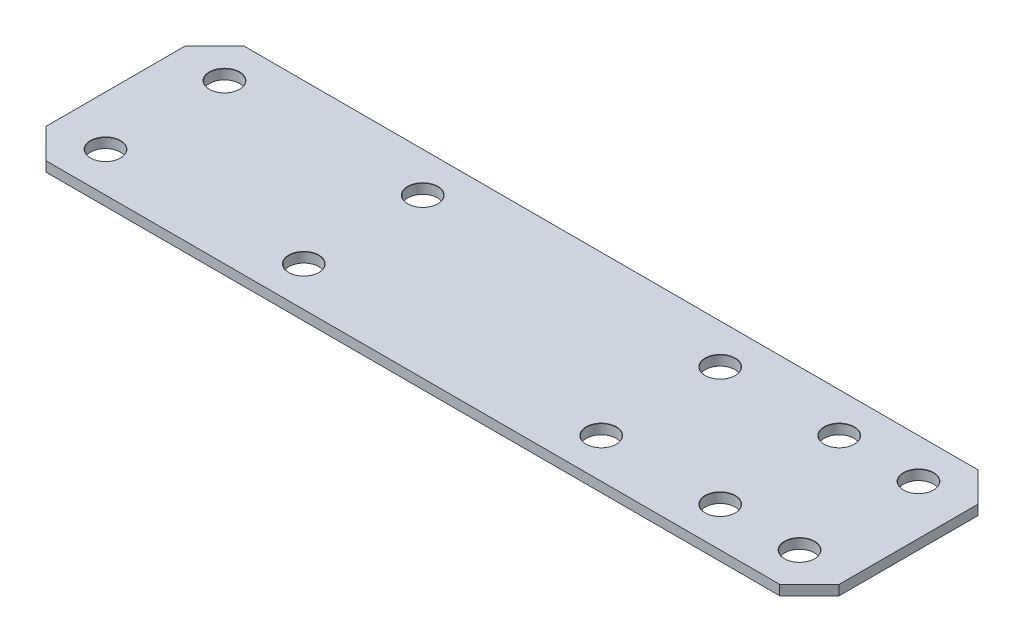
from build123d import *

# Parameters (mm, degrees)
SKETCH_1_W            = 80
SKETCH_1_H            = 20
EXTRUDE_1_DEPTH       = 1
F_3_0MM_1_AT_2_COUNT  = 2
F_3_0MM_1_AT_2_PITCH  = 12
F_3_0MM_1_AT_3_COUNT  = 2
F_3_0MM_1_AT_3_PITCH  = 20
F_3_0MM_1_AT_4_COUNT  = 2
F_3_0MM_1_AT_4_PITCH  = 50
F_3_0MM_1_AT_5_COUNT  = 2
F_3_0MM_1_AT_5_PITCH  = 23.323807579
F_3_0MM_1_AT_6_COUNT  = 2
F_3_0MM_1_AT_6_PITCH  = 51.419840529
F_3_0MM_1_AT_7_COUNT  = 2
F_3_0MM_1_AT_7_PITCH  = 71.021123618
F_3_0MM_1_AT_8_COUNT  = 2
F_3_0MM_1_AT_8_PITCH  = 70
F_3_0MM_1_AT_9_COUNT  = 2
F_3_0MM_1_AT_9_PITCH  = 62
F_3_0MM_1_AT_10_COUNT = 2
F_3_0MM_1_AT_10_PITCH = 63.150613615
CHAMFER_1_SIZE        = 3


with BuildPart() as part:
    # 草图1 → 凸台-拉伸1 (new body)
    with BuildSketch(Plane(origin=(0, 0, 0), x_dir=(1, 0, 0), z_dir=(0, 1, 0))):
        with Locations((40, 10)):
            Rectangle(SKETCH_1_W, SKETCH_1_H)
    extrude(amount=EXTRUDE_1_DEPTH)

    # 草图3 → Ø3.0mm 暗销孔1 (revolve, cut)
    with BuildSketch(Plane(origin=(5, 1, -16), x_dir=(0, 0, 1), z_dir=(1, 0, 0))):
        Polygon((0, 0), (0, 1), (1.5, 1), (1.5, 0.025), (1.525, 0), align=None)
    f_3_0mm_1 = revolve(axis=Axis((5, 7.35, -16), (0, -1, 0)), mode=Mode.SUBTRACT)

    # Ø3.0mm 暗销孔1 at 2: Ø3.0mm 暗销孔1 ×2
    with Locations(*[(0, 0, i * F_3_0MM_1_AT_2_PITCH) for i in range(1, F_3_0MM_1_AT_2_COUNT)]):
        add(f_3_0mm_1, mode=Mode.SUBTRACT)

    # Ø3.0mm 暗销孔1 at 3: Ø3.0mm 暗销孔1 ×2
    with Locations(*[(i * F_3_0MM_1_AT_3_PITCH, 0, 0) for i in range(1, F_3_0MM_1_AT_3_COUNT)]):
        add(f_3_0mm_1, mode=Mode.SUBTRACT)

    # Ø3.0mm 暗销孔1 at 4: Ø3.0mm 暗销孔1 ×2
    with Locations(*[(i * F_3_0MM_1_AT_4_PITCH, 0, 0) for i in range(1, F_3_0MM_1_AT_4_COUNT)]):
        add(f_3_0mm_1, mode=Mode.SUBTRACT)

    # Ø3.0mm 暗销孔1 at 5: Ø3.0mm 暗销孔1 ×2
    with Locations(*[Vector(0.8574929257125442, 0, 0.5144957554275265) * (i * F_3_0MM_1_AT_5_PITCH) for i in range(1, F_3_0MM_1_AT_5_COUNT)]):
        add(f_3_0mm_1, mode=Mode.SUBTRACT)

    # Ø3.0mm 暗销孔1 at 6: Ø3.0mm 暗销孔1 ×2
    with Locations(*[Vector(0.9723873019805175, 0, 0.23337295247532422) * (i * F_3_0MM_1_AT_6_PITCH) for i in range(1, F_3_0MM_1_AT_6_COUNT)]):
        add(f_3_0mm_1, mode=Mode.SUBTRACT)

    # Ø3.0mm 暗销孔1 at 7: Ø3.0mm 暗销孔1 ×2
    with Locations(*[Vector(0.9856222548132667, 0, 0.1689638151108457) * (i * F_3_0MM_1_AT_7_PITCH) for i in range(1, F_3_0MM_1_AT_7_COUNT)]):
        add(f_3_0mm_1, mode=Mode.SUBTRACT)

    # Ø3.0mm 暗销孔1 at 8: Ø3.0mm 暗销孔1 ×2
    with Locations(*[(i * F_3_0MM_1_AT_8_PITCH, 0, 0) for i in range(1, F_3_0MM_1_AT_8_COUNT)]):
        add(f_3_0mm_1, mode=Mode.SUBTRACT)

    # Ø3.0mm 暗销孔1 at 9: Ø3.0mm 暗销孔1 ×2
    with Locations(*[(i * F_3_0MM_1_AT_9_PITCH, 0, 0) for i in range(1, F_3_0MM_1_AT_9_COUNT)]):
        add(f_3_0mm_1, mode=Mode.SUBTRACT)

    # Ø3.0mm 暗销孔1 at 10: Ø3.0mm 暗销孔1 ×2
    with Locations(*[Vector(0.9817798505902814, 0, 0.1900219065658609) * (i * F_3_0MM_1_AT_10_PITCH) for i in range(1, F_3_0MM_1_AT_10_COUNT)]):
        add(f_3_0mm_1, mode=Mode.SUBTRACT)

    # 倒角1
    chamfer_1_edges = [part.edges().sort_by_distance(p)[0] for p in [
        (0, 0.5, 0),
        (80, 0.5, 0),
        (80, 0.5, -20),
        (0, 0.5, -20),
    ]]
    chamfer(chamfer_1_edges, length=CHAMFER_1_SIZE)


solid = part.part
